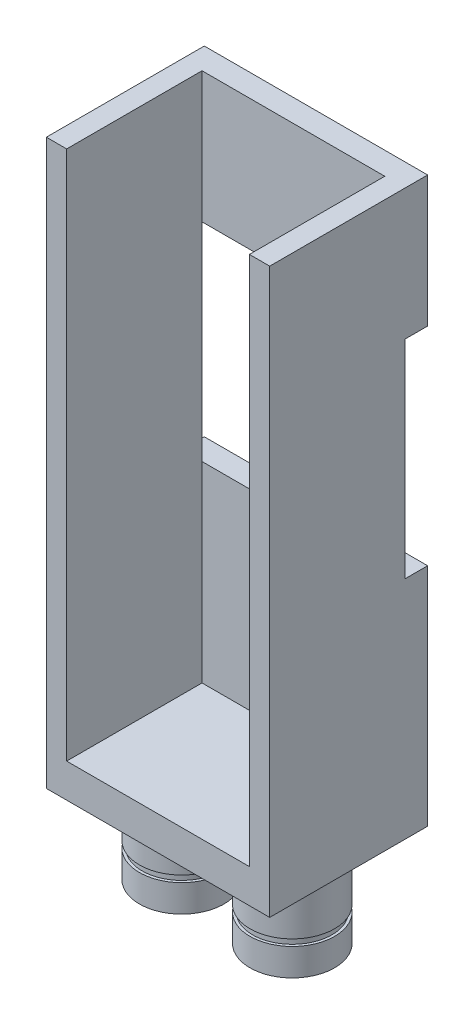
from build123d import *

# Parameters (mm, degrees)
SKETCH2_W           = 25.146
SKETCH2_H           = 17.78
BOSS_EXTRUDE1_DEPTH = 63.5
SKETCH3_W           = 20.574
SKETCH3_H           = 15.24
CUT_EXTRUDE1_DEPTH  = 59.69
SKETCH4_R           = 4.7625
BOSS_EXTRUDE2_DEPTH = 10.16
F_3DSKETCH1_R       = 5.08
CUT_EXTRUDE2_DEPTH  = 0.7366
SKETCH5_R           = 4.4577
SKETCH5_R_2         = 4.4704
BOSS_EXTRUDE3_DEPTH = 0.7366
SKETCH6_W           = 25.146
SKETCH6_H           = 23.368
CUT_EXTRUDE3_DEPTH  = 2.54


with BuildPart() as part:
    # Sketch2 → Boss-Extrude1 (new body)
    with BuildSketch(Plane(origin=(0, 0, 0), x_dir=(1, 0, 0), z_dir=(0, 1, 0))):
        Rectangle(SKETCH2_W, SKETCH2_H)
    extrude(amount=BOSS_EXTRUDE1_DEPTH)

    # Sketch3 → Cut-Extrude1 (cut)
    with BuildSketch(Plane(origin=(0, 63.5, 0), x_dir=(1, 0, 0), z_dir=(0, 1, 0))):
        with Locations((0, -1.27)):
            Rectangle(SKETCH3_W, SKETCH3_H)
    extrude(amount=-CUT_EXTRUDE1_DEPTH, mode=Mode.SUBTRACT)

    # Sketch4 → Boss-Extrude2 (add)
    with BuildSketch(Plane(origin=(0, 0, 0), x_dir=(-1, 0, 0), z_dir=(0, -1, 0))):
        with Locations(Location((6.223, 0, 0), (0, 0, 270))):
            Circle(SKETCH4_R)
        with Locations(Location((-6.223, 0, 0), (0, 0, 270))):
            Circle(SKETCH4_R)
    extrude(amount=BOSS_EXTRUDE2_DEPTH)

    # 3DSketch1 → Cut-Extrude2 (cut)
    with BuildSketch(Plane(origin=(-6.223, -6.35, 0), x_dir=(1, 0, 0), z_dir=(0, -1, 0))):
        Circle(F_3DSKETCH1_R)
        with Locations((12.446, 0)):
            Circle(F_3DSKETCH1_R)
    extrude(amount=CUT_EXTRUDE2_DEPTH, mode=Mode.SUBTRACT)


with BuildPart() as cut_extrude2_piece_1:
    # of the separate pieces the step leaves, piece 1, a body of its own (cut_extrude2_pieces)
    add(part.part.solids().sort_by_distance((-12.573, 0, -8.89))[0])



with BuildPart() as cut_extrude2_piece_2:
    # of the separate pieces the step leaves, piece 2, a body of its own (cut_extrude2_pieces)
    add(part.part.solids().sort_by_distance((6.223, -7.0866, 4.7625))[0])


with BuildPart() as cut_extrude2_piece_3:
    # of the separate pieces the step leaves, piece 3, a body of its own (cut_extrude2_pieces)
    add(part.part.solids().sort_by_distance((-6.223, -7.0866, 4.7625))[0])


with BuildPart() as cut_extrude2_piece_1_1:
    add(cut_extrude2_piece_1.part)

    add(cut_extrude2_piece_2.part)  # Boss-Extrude3 merges Cut-Extrude2 piece 2

    add(cut_extrude2_piece_3.part)  # Boss-Extrude3 merges Cut-Extrude2 piece 3
    # Sketch5 → Boss-Extrude3 (add)
    with BuildSketch(Plane(origin=(0, -6.35, 0), x_dir=(-1, 0, 0), z_dir=(0, -1, 0))):
        with Locations(Location((6.223, 0, 0), (0, 0, 90))):
            Circle(SKETCH5_R)
        with Locations(Location((-6.223, 0, 0), (0, 0, 90))):
            Circle(SKETCH5_R_2)
    extrude(amount=BOSS_EXTRUDE3_DEPTH)

    # Sketch6 → Cut-Extrude3 (cut)
    with BuildSketch(Plane(origin=(0, 0, -8.89), x_dir=(-1, 0, 0), z_dir=(0, 0, -1))):
        with Locations((0, 37.084)):
            Rectangle(SKETCH6_W, SKETCH6_H)
    extrude(amount=-CUT_EXTRUDE3_DEPTH, mode=Mode.SUBTRACT)


solid = cut_extrude2_piece_1_1.part
